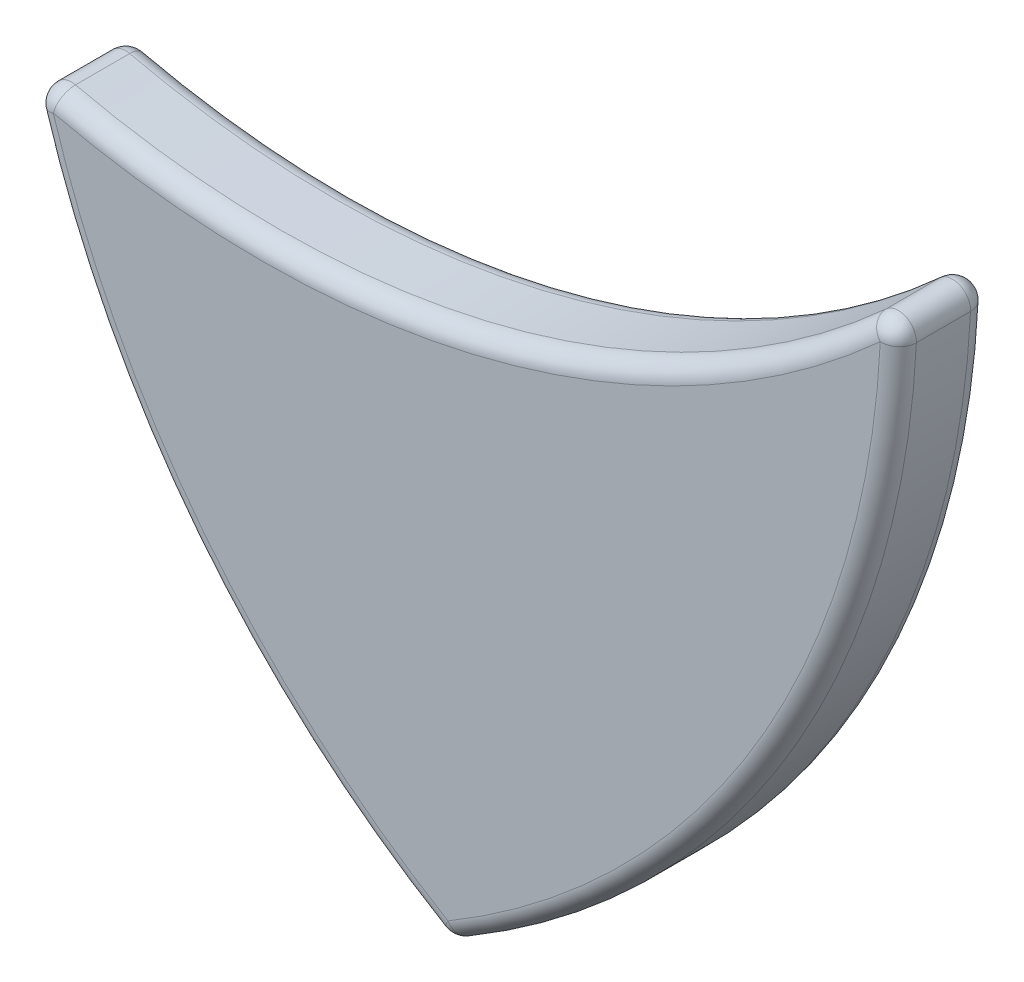
from build123d import *

# Parameters (mm, degrees)
ESTRUSIONE_ESTRUSIONE1_DEPTH = 5
RACCORDO1_R                  = 1


with BuildPart() as part:
    # Schizzo1 → Estrusione-Estrusione1 (new body)
    with BuildSketch(Plane.XY):
        with BuildLine():
            ThreePointArc((-48.296291314, -12.940952255), (-39.667667015, -30.43807145), (-25, -43.301270189))
            ThreePointArc((-25, -43.301270189), (-6.698729811, -25), (0, 0))
            ThreePointArc((0, 0), (-22.414386804, -12.940952255), (-48.296291314, -12.940952255))
        make_face()
    extrude(amount=ESTRUSIONE_ESTRUSIONE1_DEPTH)

    # Raccordo1
    raccordo1_edges = [part.edges().sort_by_distance(p)[0] for p in [
        (-39.667667015, -30.43807145, 5),
        (-39.667667015, -30.43807145, 0),
        (-22.414386804, -12.940952255, 0),
        (-6.698729811, -25, 0),
        (-6.698729811, -25, 5),
        (-25, -43.301270189, 2.5),
        (-48.296291314, -12.940952255, 2.5),
        (0, 0, 2.5),
        (-22.414386804, -12.940952255, 5),
    ]]
    fillet(raccordo1_edges, radius=RACCORDO1_R)


solid = part.part
